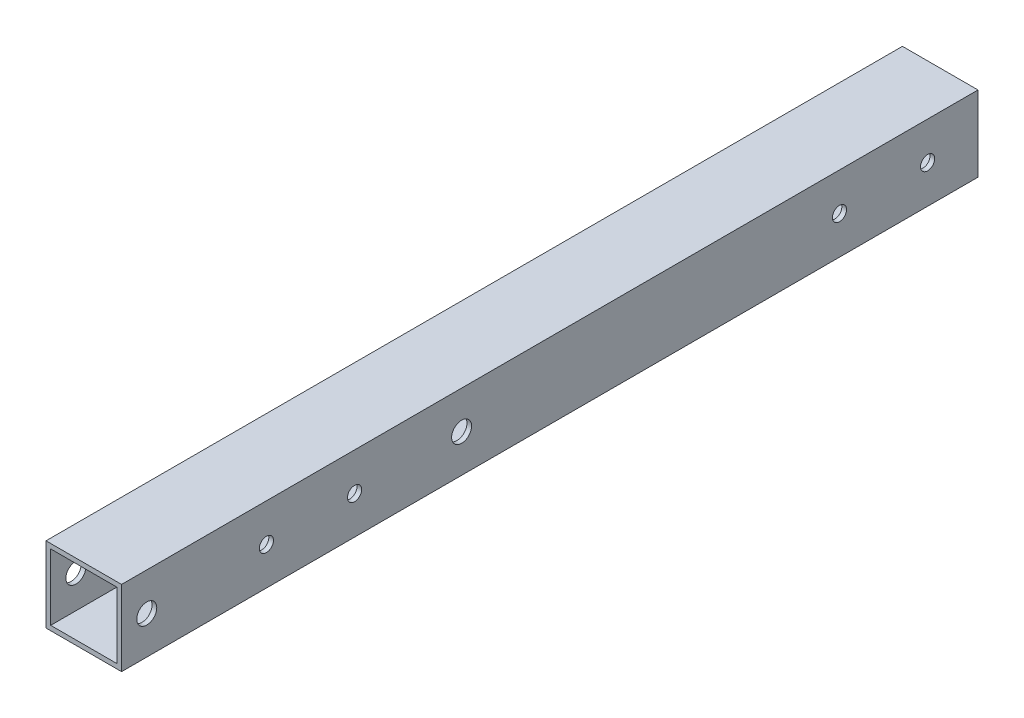
from build123d import *

# Parameters (mm, degrees)
SKETCH1_W               = 38.1
SKETCH1_H               = 38.1
SKETCH1_W_2             = 33.3756
SKETCH1_H_2             = 33.3756
EXTRUDE1_DEPTH          = 431.8
F_1_4_CLEARANCE_HOLE1_D = 7.14248
F_3_8_CLEARANCE_HOLE1_D = 10.0838


with BuildPart() as part:
    # Sketch1 → Extrude1 (new body)
    with BuildSketch(Plane.XY):
        Rectangle(SKETCH1_W, SKETCH1_H)
        Rectangle(SKETCH1_W_2, SKETCH1_H_2, mode=Mode.SUBTRACT)
    extrude(amount=EXTRUDE1_DEPTH)

    # 1/4 Clearance Hole1 (through all)
    with Locations(Plane(origin=(19.05, 0, 358.775), x_dir=(0, 1, 0), z_dir=(1, 0, 0))):
        with Locations((0, 0), (0, -44.45), (0, -288.925), (0, -333.375)):
            Hole(F_1_4_CLEARANCE_HOLE1_D / 2)

    # 3/8 Clearance Hole1 (through all)
    with Locations(Plane(origin=(19.05, 0, 419.1), x_dir=(0, 1, 0), z_dir=(1, 0, 0))):
        with Locations((0, 0), (0, -158.75)):
            Hole(F_3_8_CLEARANCE_HOLE1_D / 2)


solid = part.part
